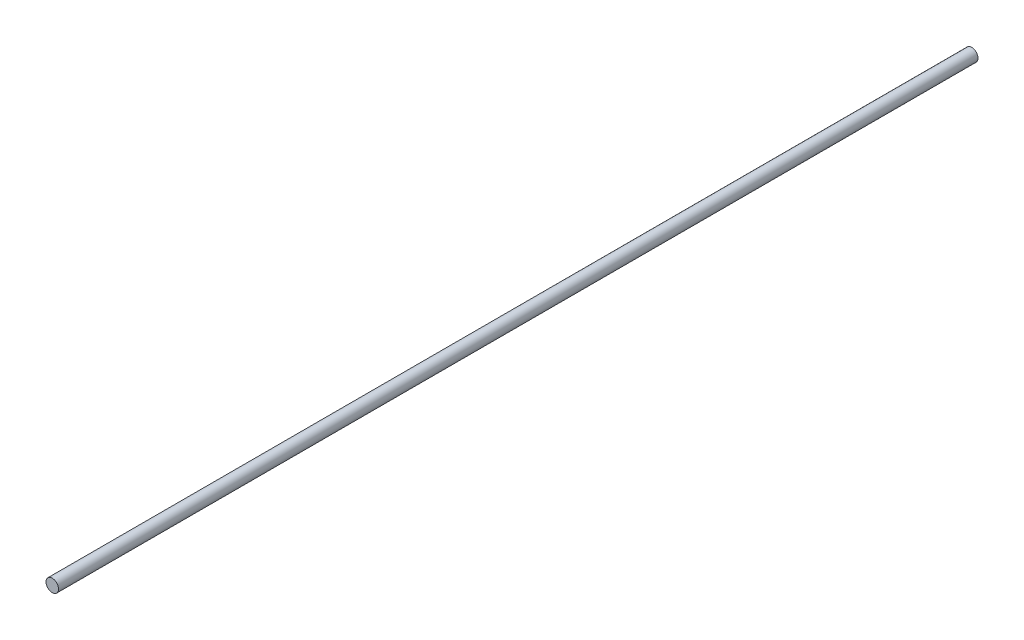
from build123d import *

# Parameters (mm, degrees)
BOSS_EXTRUDE1_DEPTH      = 110
BOSS_EXTRUDE1_DEPTH_BACK = 110
SKETCH1_R                = 1.5


with BuildPart() as part:
    # Sketch1 → Boss-Extrude1 (new, two sides: drawn at the far end of the back side and taken through both)
    with BuildSketch(Plane.XY.offset(-BOSS_EXTRUDE1_DEPTH_BACK)):
        Circle(SKETCH1_R)
    extrude(amount=BOSS_EXTRUDE1_DEPTH + BOSS_EXTRUDE1_DEPTH_BACK)


solid = part.part
